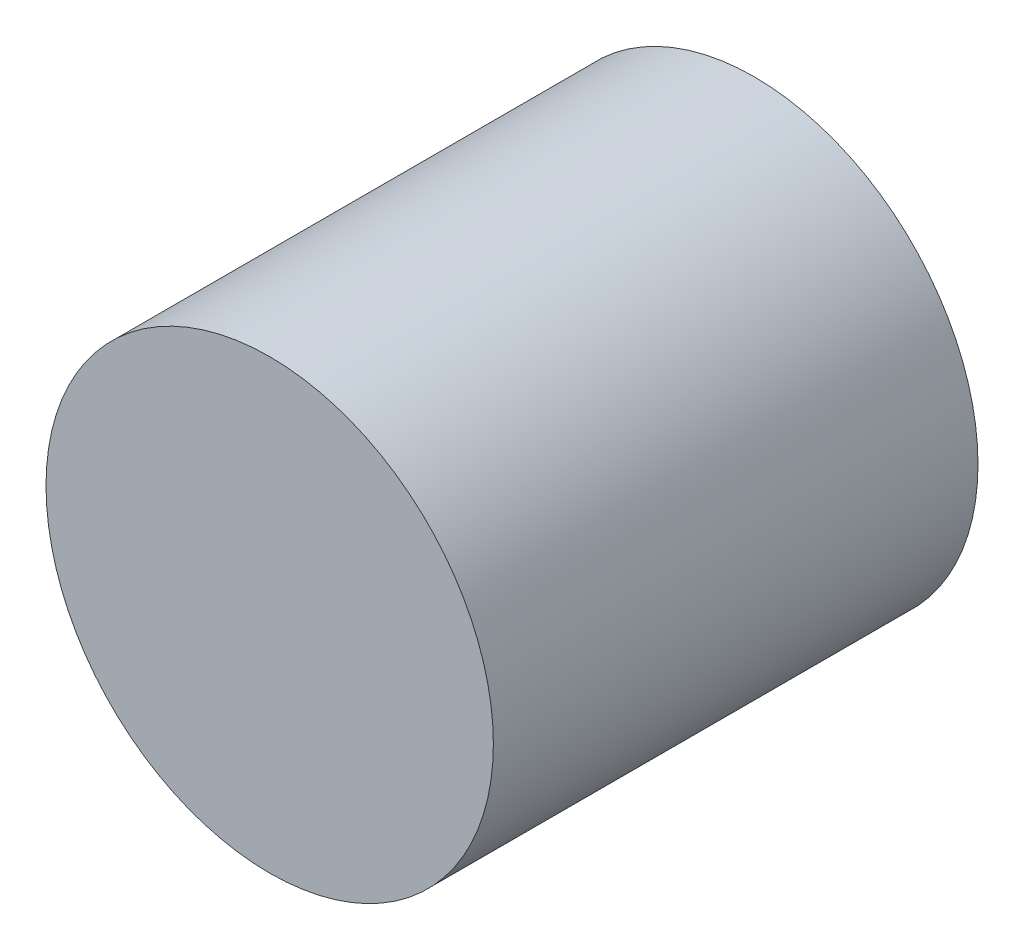
from build123d import *

# Parameters (mm, degrees)
SKETCH1_R     = 6
PROFILE_DEPTH = 13


with BuildPart() as part:
    # Sketch1 → Profile (new body)
    with BuildSketch(Plane.XY):
        with Locations(Location((6, 6, 0), (0, 0, 180))):
            Circle(SKETCH1_R)
    extrude(amount=PROFILE_DEPTH)


solid = part.part
